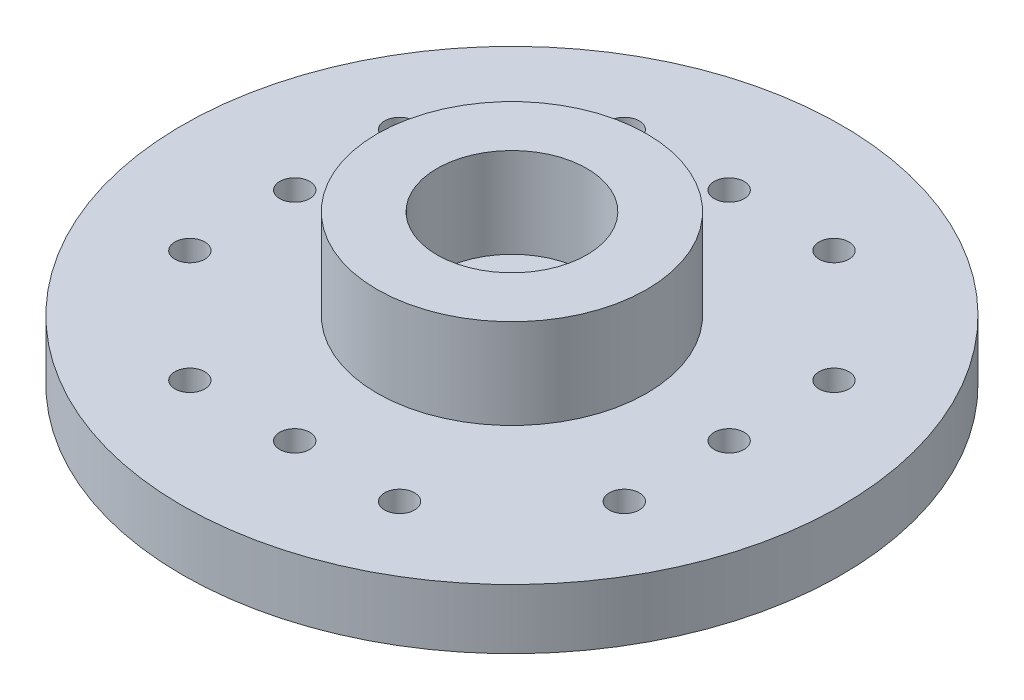
from build123d import *

# Parameters (mm, degrees)
SKETCH1_R           = 11
SKETCH1_R_2         = 1.5
BOSS_EXTRUDE1_DEPTH = 2
SKETCH2_R           = 4.5
SKETCH2_R_2         = 2.5
BOSS_EXTRUDE2_DEPTH = 3
SKETCH3_R           = 0.5
CUT_EXTRUDE1_DEPTH  = 16.842979518
CIRPATTERN1_COUNT   = 4


with BuildPart() as part:
    # Sketch1 → Boss-Extrude1 (new body)
    with BuildSketch(Plane(origin=(0, 0, 0), x_dir=(1, 0, 0), z_dir=(0, 1, 0))):
        with Locations(Location((0, 0, 0), (0, 0, 270))):
            Circle(SKETCH1_R)
        with Locations(Location((0, 0, 0), (0, 0, 270))):
            Circle(SKETCH1_R_2, mode=Mode.SUBTRACT)
    extrude(amount=BOSS_EXTRUDE1_DEPTH)

    # Sketch2 → Boss-Extrude2 (add)
    with BuildSketch(Plane(origin=(0, 2, 0), x_dir=(1, 0, 0), z_dir=(0, 1, 0))):
        with Locations(Location((0, 0, 0), (0, 0, 270))):
            Circle(SKETCH2_R)
        with Locations(Location((0, 0, 0), (0, 0, 270))):
            Circle(SKETCH2_R_2, mode=Mode.SUBTRACT)
    extrude(amount=BOSS_EXTRUDE2_DEPTH)

    # Sketch3 → Cut-Extrude1 (cut, through all)
    with BuildSketch(Plane(origin=(0, 2, 0), x_dir=(1, 0, 0), z_dir=(0, 1, 0))):
        with Locations(Location((-3.5, 7.25, 0), (0, 0, 270))):
            Circle(SKETCH3_R)
        with Locations(Location((0, 7.25, 0), (0, 0, 270))):
            Circle(SKETCH3_R)
        with Locations(Location((3.5, 7.25, 0), (0, 0, 270))):
            Circle(SKETCH3_R)
    cut_extrude1 = extrude(amount=-CUT_EXTRUDE1_DEPTH, mode=Mode.SUBTRACT)

    # CirPattern1: Cut-Extrude1 ×4 about axis
    cirpattern1_axis = Axis((0, 0, 0), (0, 1, 0))
    for i in range(1, CIRPATTERN1_COUNT):
        add(cut_extrude1.rotate(cirpattern1_axis, i * 360 / CIRPATTERN1_COUNT), mode=Mode.SUBTRACT)


solid = part.part
